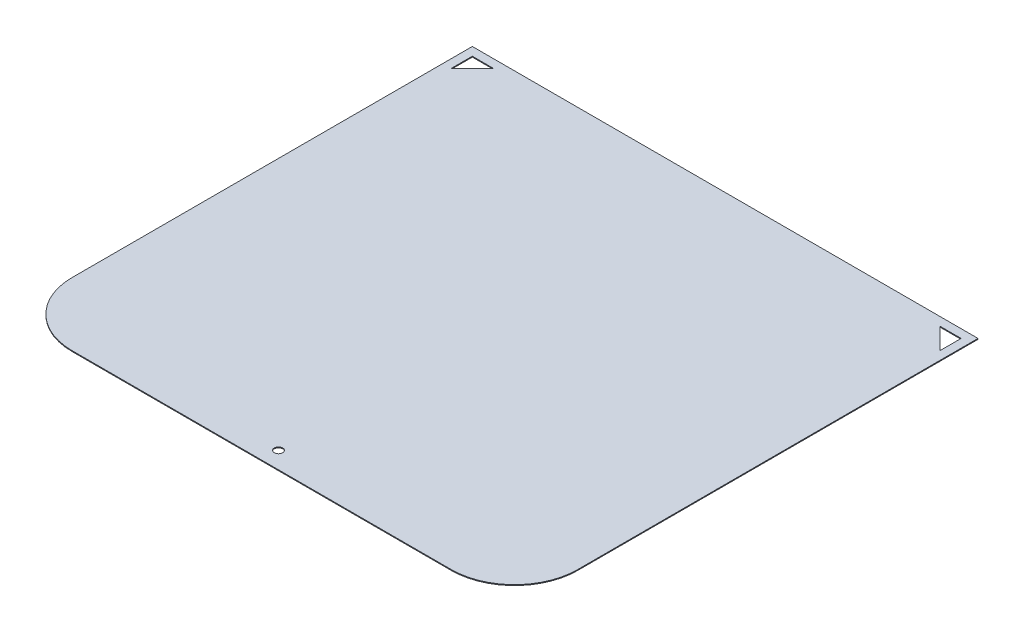
from build123d import *

# Parameters (mm, degrees)
SKETCH1_W           = 120
SKETCH1_H           = 110
BOSS_EXTRUDE1_DEPTH = 0.2
FILLET1_R           = 15
SKETCH2_R           = 1
CUT_EXTRUDE1_DEPTH  = 5


with BuildPart() as part:
    # Sketch1 → Boss-Extrude1 (new body)
    with BuildSketch(Plane(origin=(0, 0, 0), x_dir=(1, 0, 0), z_dir=(0, 1, 0))):
        with Locations((60, 55)):
            Rectangle(SKETCH1_W, SKETCH1_H)
    extrude(amount=BOSS_EXTRUDE1_DEPTH)

    # Fillet1
    fillet1_edges = [part.edges().sort_by_distance(p)[0] for p in [
        (120, 0.1, 0),
        (0, 0.1, 0),
    ]]
    fillet(fillet1_edges, radius=FILLET1_R)

    # Sketch2 → Cut-Extrude1 (cut)
    with BuildSketch(Plane(origin=(0, 0.2, 0), x_dir=(1, 0, 0), z_dir=(0, 1, 0))):
        with Locations(Location((60, 4, 0), (0, 0, 270))):
            Circle(SKETCH2_R)
        Polygon((2, 108), (7, 108), (2, 103), align=None)
        Polygon((118, 103), (118, 108), (113, 108), align=None)
    extrude(amount=-CUT_EXTRUDE1_DEPTH, mode=Mode.SUBTRACT)


solid = part.part
